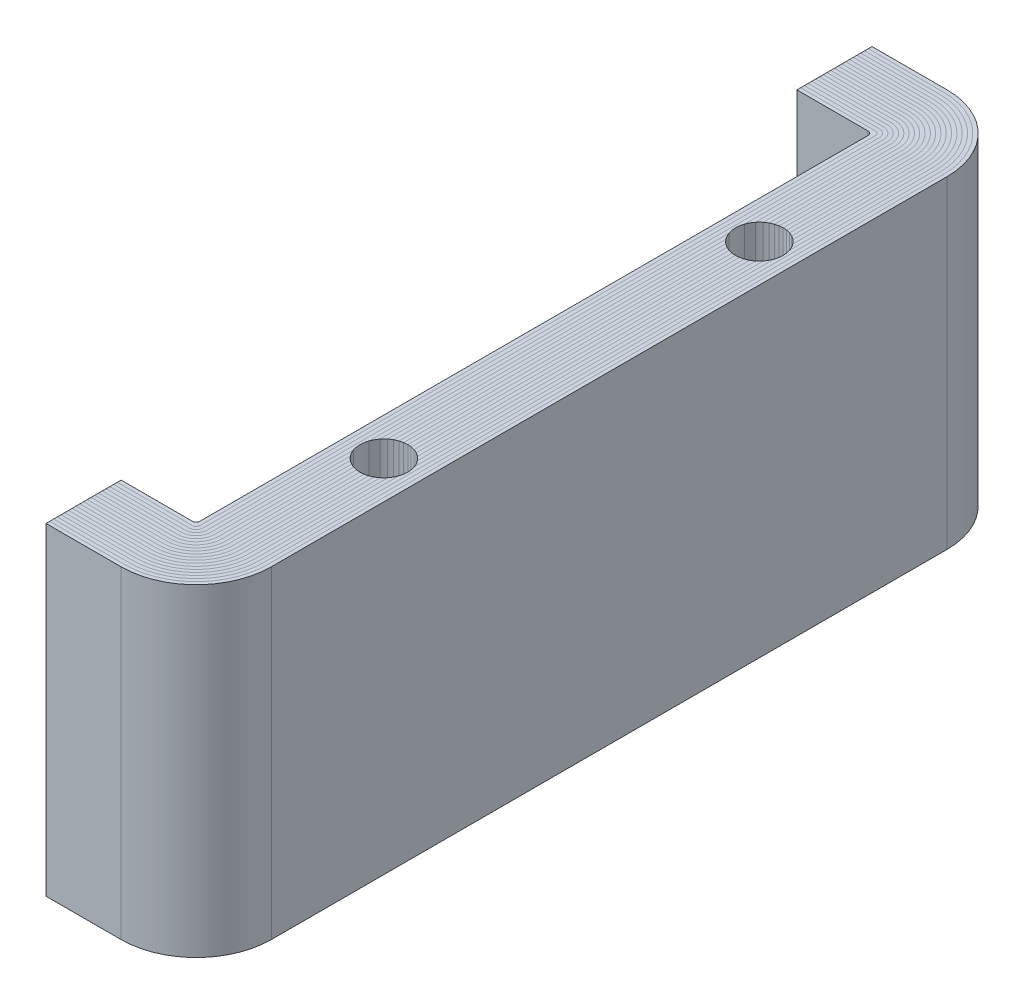
from build123d import *

# Parameters (mm, degrees)
ESBO_O2_W                                    = 110
ESBO_O2_H                                    = 43
RESSALTO_EXTRUS_O7_DEPTH                     = 0.5
ESBO_O18_W                                   = 10
ESBO_O18_H                                   = 43
RESSALTO_EXTRUS_O8_DEPTH                     = 19.5
CORTE_EXTRUS_O6_DEPTH                        = 120.704845349
CORTE_EXTRUS_O7_DEPTH                        = 120.704845349
RESSALTO_EXTRUS_O20_DEPTH                    = 43
RESSALTO_EXTRUS_O21_DEPTH                    = 43
RESSALTO_EXTRUS_O22_DEPTH                    = 43
RESSALTO_EXTRUS_O23_DEPTH                    = 43
RESSALTO_EXTRUS_O24_DEPTH                    = 43
RESSALTO_EXTRUS_O25_DEPTH                    = 43
RESSALTO_EXTRUS_O26_DEPTH                    = 43
RESSALTO_EXTRUS_O27_DEPTH                    = 43
RESSALTO_EXTRUS_O28_DEPTH                    = 43
RESSALTO_EXTRUS_O29_DEPTH                    = 43
RESSALTO_EXTRUS_O30_DEPTH                    = 43
RESSALTO_EXTRUS_O31_DEPTH                    = 43
RESSALTO_EXTRUS_O32_DEPTH                    = 43
RESSALTO_EXTRUS_O33_DEPTH                    = 43
RESSALTO_EXTRUS_O34_DEPTH                    = 43
RESSALTO_EXTRUS_O35_DEPTH                    = 43
RESSALTO_EXTRUS_O37_DEPTH                    = 43
RESSALTO_EXTRUS_O38_DEPTH                    = 43
RESSALTO_EXTRUS_O39_DEPTH                    = 43
BROCA_DE_ROSQUEAR_PARA_TARRAXA_DE_M3_2_COUNT = 2
BROCA_DE_ROSQUEAR_PARA_TARRAXA_DE_M3_2_PITCH = 50


with BuildPart() as part:
    # Esboço2 → Ressalto-extrusão7 (new body)
    with BuildSketch(Plane(origin=(0, 0, 0), x_dir=(0, 0, -1), z_dir=(1, 0, 0))):
        with Locations((-55, 21.5)):
            Rectangle(ESBO_O2_W, ESBO_O2_H)
    extrude(amount=RESSALTO_EXTRUS_O7_DEPTH)

    # Esboço18 → Ressalto-extrusão8 (add)
    with BuildSketch(Plane.ZY):
        with Locations((5, 21.5)):
            Rectangle(ESBO_O18_W, ESBO_O18_H)
        with Locations((105, 21.5)):
            Rectangle(ESBO_O18_W, ESBO_O18_H)
    extrude(amount=RESSALTO_EXTRUS_O8_DEPTH)

    # Esboço29 → Corte-extrusão6 (cut, through all)
    with BuildSketch(Plane(origin=(0, 43, 0), x_dir=(1, 0, 0), z_dir=(0, 1, 0))):
        with BuildLine():
            Line((-9.5, -110), (0.5, -110))
            Line((0.5, -110), (0.5, -100))
            ThreePointArc((0.5, -100), (-2.428932188, -107.071067812), (-9.5, -110))
        make_face()
        with BuildLine():
            Line((0.5, -10), (0.5, 0))
            Line((0.5, 0), (-9.5, 0))
            ThreePointArc((-9.5, 0), (-2.428932188, -2.928932188), (0.5, -10))
        make_face()
    extrude(amount=-CORTE_EXTRUS_O6_DEPTH, mode=Mode.SUBTRACT)

    # Esboço30 → Corte-extrusão7 (cut, through all)
    with BuildSketch(Plane(origin=(0, 43, 0), x_dir=(1, 0, 0), z_dir=(0, 1, 0))):
        with BuildLine():
            Line((-9.5, -109.5), (-19.5, -109.5))
            Line((-19.5, -109.5), (-19.5, -100))
            Line((-19.5, -100), (0, -100))
            ThreePointArc((0, -100), (-2.782485579, -106.717514421), (-9.5, -109.5))
        make_face()
        with BuildLine():
            Line((-9.5, -0.5), (-19.5, -0.5))
            Line((-19.5, -0.5), (-19.5, -10))
            Line((-19.5, -10), (0, -10))
            ThreePointArc((0, -10), (-2.782485579, -3.282485579), (-9.5, -0.5))
        make_face()
    extrude(amount=-CORTE_EXTRUS_O7_DEPTH, mode=Mode.SUBTRACT)


with BuildPart() as body_2:
    # Esboço31 → Ressalto-extrusão20 (new body)
    with BuildSketch(Plane(origin=(0, 43, 0), x_dir=(1, 0, 0), z_dir=(0, 1, 0))):
        with BuildLine():
            Line((-9.5, -109.5), (-19.5, -109.5))
            Line((-19.5, -109.5), (-19.5, -109))
            Line((-19.5, -109), (-9.5, -109))
            ThreePointArc((-9.5, -109), (-3.136038969, -106.363961031), (-0.5, -100))
            Line((-0.5, -100), (-0.5, -10))
            ThreePointArc((-0.5, -10), (-3.136038969, -3.636038969), (-9.5, -1))
            Line((-9.5, -1), (-19.5, -1))
            Line((-19.5, -1), (-19.5, -0.5))
            Line((-19.5, -0.5), (-9.5, -0.5))
            ThreePointArc((-9.5, -0.5), (-2.782485579, -3.282485579), (0, -10))
            Line((0, -10), (0, -100))
            ThreePointArc((0, -100), (-2.782485579, -106.717514421), (-9.5, -109.5))
        make_face()
    extrude(amount=-RESSALTO_EXTRUS_O20_DEPTH)


with BuildPart() as body_3:
    # Esboço32 → Ressalto-extrusão21 (new body)
    with BuildSketch(Plane(origin=(0, 43, 0), x_dir=(1, 0, 0), z_dir=(0, 1, 0))):
        with BuildLine():
            Line((-9.5, -1.5), (-19.5, -1.5))
            Line((-19.5, -1.5), (-19.5, -1))
            Line((-19.5, -1), (-9.5, -1))
            ThreePointArc((-9.5, -1), (-3.136038969, -3.636038969), (-0.5, -10))
            Line((-0.5, -10), (-0.5, -100))
            ThreePointArc((-0.5, -100), (-3.136038969, -106.363961031), (-9.5, -109))
            Line((-9.5, -109), (-19.5, -109))
            Line((-19.5, -109), (-19.5, -108.5))
            Line((-19.5, -108.5), (-9.5, -108.5))
            ThreePointArc((-9.5, -108.5), (-3.48959236, -106.01040764), (-1, -100))
            Line((-1, -100), (-1, -10))
            ThreePointArc((-1, -10), (-3.48959236, -3.98959236), (-9.5, -1.5))
        make_face()
    extrude(amount=-RESSALTO_EXTRUS_O21_DEPTH)


with BuildPart() as body_4:
    # Esboço33 → Ressalto-extrusão22 (new body)
    with BuildSketch(Plane(origin=(0, 43, 0), x_dir=(1, 0, 0), z_dir=(0, 1, 0))):
        with BuildLine():
            Line((-9.5, -1.5), (-19.5, -1.5))
            Line((-19.5, -1.5), (-19.5, -2))
            Line((-19.5, -2), (-9.5, -2))
            ThreePointArc((-9.5, -2), (-3.843145751, -4.343145751), (-1.5, -10))
            Line((-1.5, -10), (-1.5, -100))
            ThreePointArc((-1.5, -100), (-3.843145751, -105.656854249), (-9.5, -108))
            Line((-9.5, -108), (-19.5, -108))
            Line((-19.5, -108), (-19.5, -108.5))
            Line((-19.5, -108.5), (-9.5, -108.5))
            ThreePointArc((-9.5, -108.5), (-3.48959236, -106.01040764), (-1, -100))
            Line((-1, -100), (-1, -10))
            ThreePointArc((-1, -10), (-3.48959236, -3.98959236), (-9.5, -1.5))
        make_face()
    extrude(amount=-RESSALTO_EXTRUS_O22_DEPTH)


with BuildPart() as body_5:
    # Esboço34 → Ressalto-extrusão23 (new body)
    with BuildSketch(Plane(origin=(0, 43, 0), x_dir=(1, 0, 0), z_dir=(0, 1, 0))):
        with BuildLine():
            Line((-9.5, -108), (-19.5, -108))
            Line((-19.5, -108), (-19.5, -107.5))
            Line((-19.5, -107.5), (-9.5, -107.5))
            ThreePointArc((-9.5, -107.5), (-4.196699141, -105.303300859), (-2, -100))
            Line((-2, -100), (-2, -10))
            ThreePointArc((-2, -10), (-4.196699141, -4.696699141), (-9.5, -2.5))
            Line((-9.5, -2.5), (-19.5, -2.5))
            Line((-19.5, -2.5), (-19.5, -2))
            Line((-19.5, -2), (-9.5, -2))
            ThreePointArc((-9.5, -2), (-3.843145751, -4.343145751), (-1.5, -10))
            Line((-1.5, -10), (-1.5, -100))
            ThreePointArc((-1.5, -100), (-3.843145751, -105.656854249), (-9.5, -108))
        make_face()
    extrude(amount=-RESSALTO_EXTRUS_O23_DEPTH)


with BuildPart() as body_6:
    # Esboço35 → Ressalto-extrusão24 (new body)
    with BuildSketch(Plane(origin=(0, 43, 0), x_dir=(1, 0, 0), z_dir=(0, 1, 0))):
        with BuildLine():
            Line((-9.5, -107.5), (-19.5, -107.5))
            Line((-19.5, -107.5), (-19.5, -106.999999869))
            Line((-19.5, -106.999999869), (-9.5, -106.999999869))
            ThreePointArc((-9.5, -106.999999869), (-4.550252532, -104.949747468), (-2.5, -100))
            Line((-2.5, -100), (-2.5, -10))
            ThreePointArc((-2.5, -10), (-4.550252532, -5.050252532), (-9.5, -3))
            Line((-9.5, -3), (-19.5, -3))
            Line((-19.5, -3), (-19.5, -2.5))
            Line((-19.5, -2.5), (-9.5, -2.5))
            ThreePointArc((-9.5, -2.5), (-4.196699141, -4.696699141), (-2, -10))
            Line((-2, -10), (-2, -100))
            ThreePointArc((-2, -100), (-4.196699141, -105.303300859), (-9.5, -107.5))
        make_face()
    extrude(amount=-RESSALTO_EXTRUS_O24_DEPTH)


with BuildPart() as body_7:
    # Esboço36 → Ressalto-extrusão25 (new body)
    with BuildSketch(Plane(origin=(0, 43, 0), x_dir=(1, 0, 0), z_dir=(0, 1, 0))):
        with BuildLine():
            Line((-9.5, -106.999999869), (-19.5, -106.999999869))
            Line((-19.5, -106.999999869), (-19.5, -106.5))
            Line((-19.5, -106.5), (-9.5, -106.5))
            ThreePointArc((-9.5, -106.5), (-4.903805922, -104.596194078), (-3, -100))
            Line((-3, -100), (-3, -10))
            ThreePointArc((-3, -10), (-4.903805922, -5.403805922), (-9.5, -3.5))
            Line((-9.5, -3.5), (-19.5, -3.5))
            Line((-19.5, -3.5), (-19.5, -3))
            Line((-19.5, -3), (-9.5, -3))
            ThreePointArc((-9.5, -3), (-4.550252555, -5.050252555), (-2.500000033, -10))
            Line((-2.500000033, -10), (-2.500000033, -100))
            ThreePointArc((-2.500000033, -100), (-4.550252555, -104.949747445), (-9.5, -106.999999869))
        make_face()
    extrude(amount=-RESSALTO_EXTRUS_O25_DEPTH)


with BuildPart() as body_8:
    # Esboço38 → Ressalto-extrusão26 (new body)
    with BuildSketch(Plane(origin=(0, 43, 0), x_dir=(1, 0, 0), z_dir=(0, 1, 0))):
        with BuildLine():
            Line((-9.5, -106.5), (-19.5, -106.5))
            Line((-19.5, -106.5), (-19.5, -106))
            Line((-19.5, -106), (-9.5, -106))
            ThreePointArc((-9.5, -106), (-5.257359313, -104.242640687), (-3.5, -100))
            Line((-3.5, -100), (-3.5, -10))
            ThreePointArc((-3.5, -10), (-5.257359313, -5.757359313), (-9.5, -4))
            Line((-9.5, -4), (-19.5, -4))
            Line((-19.5, -4), (-19.5, -3.5))
            Line((-19.5, -3.5), (-9.5, -3.5))
            ThreePointArc((-9.5, -3.5), (-4.903805922, -5.403805922), (-3, -10))
            Line((-3, -10), (-3, -100))
            ThreePointArc((-3, -100), (-4.903805922, -104.596194078), (-9.5, -106.5))
        make_face()
    extrude(amount=-RESSALTO_EXTRUS_O26_DEPTH)


with BuildPart() as body_9:
    # Esboço39 → Ressalto-extrusão27 (new body)
    with BuildSketch(Plane(origin=(0, 43, 0), x_dir=(1, 0, 0), z_dir=(0, 1, 0))):
        with BuildLine():
            Line((-9.5, -106), (-19.5, -106))
            Line((-19.5, -106), (-19.5, -105.5))
            Line((-19.5, -105.5), (-9.5, -105.5))
            ThreePointArc((-9.5, -105.5), (-5.610912703, -103.889087297), (-4, -100))
            Line((-4, -100), (-4, -10))
            ThreePointArc((-4, -10), (-5.610912703, -6.110912703), (-9.5, -4.5))
            Line((-9.5, -4.5), (-19.5, -4.5))
            Line((-19.5, -4.5), (-19.5, -4))
            Line((-19.5, -4), (-9.5, -4))
            ThreePointArc((-9.5, -4), (-5.257359313, -5.757359313), (-3.5, -10))
            Line((-3.5, -10), (-3.5, -100))
            ThreePointArc((-3.5, -100), (-5.257359313, -104.242640687), (-9.5, -106))
        make_face()
    extrude(amount=-RESSALTO_EXTRUS_O27_DEPTH)


with BuildPart() as body_10:
    # Esboço40 → Ressalto-extrusão28 (new body)
    with BuildSketch(Plane(origin=(0, 43, 0), x_dir=(1, 0, 0), z_dir=(0, 1, 0))):
        with BuildLine():
            Line((-9.5, -105.5), (-19.5, -105.5))
            Line((-19.5, -105.5), (-19.5, -105))
            Line((-19.5, -105), (-9.5, -105))
            ThreePointArc((-9.5, -105), (-5.964466094, -103.535533906), (-4.5, -100))
            Line((-4.5, -100), (-4.5, -10))
            ThreePointArc((-4.5, -10), (-5.964466094, -6.464466094), (-9.5, -5))
            Line((-9.5, -5), (-19.5, -5))
            Line((-19.5, -5), (-19.5, -4.5))
            Line((-19.5, -4.5), (-9.5, -4.5))
            ThreePointArc((-9.5, -4.5), (-5.610912703, -6.110912703), (-4, -10))
            Line((-4, -10), (-4, -100))
            ThreePointArc((-4, -100), (-5.610912703, -103.889087297), (-9.5, -105.5))
        make_face()
    extrude(amount=-RESSALTO_EXTRUS_O28_DEPTH)


with BuildPart() as body_11:
    # Esboço41 → Ressalto-extrusão29 (new body)
    with BuildSketch(Plane(origin=(0, 43, 0), x_dir=(1, 0, 0), z_dir=(0, 1, 0))):
        with BuildLine():
            Line((-9.5, -105), (-19.5, -105))
            Line((-19.5, -105), (-19.5, -104.5))
            Line((-19.5, -104.5), (-9.5, -104.5))
            ThreePointArc((-9.5, -104.5), (-6.318019485, -103.181980515), (-5, -100))
            Line((-5, -100), (-5, -10))
            ThreePointArc((-5, -10), (-6.318019485, -6.818019485), (-9.5, -5.5))
            Line((-9.5, -5.5), (-19.5, -5.5))
            Line((-19.5, -5.5), (-19.5, -5))
            Line((-19.5, -5), (-9.5, -5))
            ThreePointArc((-9.5, -5), (-5.964466094, -6.464466094), (-4.5, -10))
            Line((-4.5, -10), (-4.5, -100))
            ThreePointArc((-4.5, -100), (-5.964466094, -103.535533906), (-9.5, -105))
        make_face()
    extrude(amount=-RESSALTO_EXTRUS_O29_DEPTH)


with BuildPart() as body_12:
    # Esboço42 → Ressalto-extrusão30 (new body)
    with BuildSketch(Plane(origin=(0, 43, 0), x_dir=(1, 0, 0), z_dir=(0, 1, 0))):
        with BuildLine():
            Line((-9.5, -104.5), (-19.5, -104.5))
            Line((-19.5, -104.5), (-19.5, -104))
            Line((-19.5, -104), (-9.5, -104))
            ThreePointArc((-9.5, -104), (-6.671572875, -102.828427125), (-5.5, -100))
            Line((-5.5, -100), (-5.5, -10))
            ThreePointArc((-5.5, -10), (-6.671572875, -7.171572875), (-9.5, -6))
            Line((-9.5, -6), (-19.5, -6))
            Line((-19.5, -6), (-19.5, -5.5))
            Line((-19.5, -5.5), (-9.5, -5.5))
            ThreePointArc((-9.5, -5.5), (-6.318019485, -6.818019485), (-5, -10))
            Line((-5, -10), (-5, -100))
            ThreePointArc((-5, -100), (-6.318019485, -103.181980515), (-9.5, -104.5))
        make_face()
    extrude(amount=-RESSALTO_EXTRUS_O30_DEPTH)


with BuildPart() as body_13:
    # Esboço43 → Ressalto-extrusão31 (new body)
    with BuildSketch(Plane(origin=(0, 43, 0), x_dir=(1, 0, 0), z_dir=(0, 1, 0))):
        with BuildLine():
            Line((-9.5, -104), (-19.5, -104))
            Line((-19.5, -104), (-19.5, -103.5))
            Line((-19.5, -103.5), (-9.5, -103.5))
            ThreePointArc((-9.5, -103.5), (-7.025126266, -102.474873734), (-6, -100))
            Line((-6, -100), (-6, -10))
            ThreePointArc((-6, -10), (-7.025126266, -7.525126266), (-9.5, -6.5))
            Line((-9.5, -6.5), (-19.5, -6.5))
            Line((-19.5, -6.5), (-19.5, -6))
            Line((-19.5, -6), (-9.5, -6))
            ThreePointArc((-9.5, -6), (-6.671572875, -7.171572875), (-5.5, -10))
            Line((-5.5, -10), (-5.5, -100))
            ThreePointArc((-5.5, -100), (-6.671572875, -102.828427125), (-9.5, -104))
        make_face()
    extrude(amount=-RESSALTO_EXTRUS_O31_DEPTH)


with BuildPart() as body_14:
    # Esboço44 → Ressalto-extrusão32 (new body)
    with BuildSketch(Plane(origin=(0, 43, 0), x_dir=(1, 0, 0), z_dir=(0, 1, 0))):
        with BuildLine():
            Line((-9.5, -103.5), (-19.5, -103.5))
            Line((-19.5, -103.5), (-19.5, -103))
            Line((-19.5, -103), (-9.5, -103))
            ThreePointArc((-9.5, -103), (-7.378679656, -102.121320344), (-6.5, -100))
            Line((-6.5, -100), (-6.5, -10))
            ThreePointArc((-6.5, -10), (-7.378679656, -7.878679656), (-9.5, -7))
            Line((-9.5, -7), (-19.5, -7))
            Line((-19.5, -7), (-19.5, -6.5))
            Line((-19.5, -6.5), (-9.5, -6.5))
            ThreePointArc((-9.5, -6.5), (-7.025126266, -7.525126266), (-6, -10))
            Line((-6, -10), (-6, -100))
            ThreePointArc((-6, -100), (-7.025126266, -102.474873734), (-9.5, -103.5))
        make_face()
    extrude(amount=-RESSALTO_EXTRUS_O32_DEPTH)


with BuildPart() as body_15:
    # Esboço45 → Ressalto-extrusão33 (new body)
    with BuildSketch(Plane(origin=(0, 43, 0), x_dir=(1, 0, 0), z_dir=(0, 1, 0))):
        with BuildLine():
            Line((-9.5, -103), (-19.5, -103))
            Line((-19.5, -103), (-19.5, -102.5))
            Line((-19.5, -102.5), (-9.5, -102.5))
            ThreePointArc((-9.5, -102.5), (-7.732233047, -101.767766953), (-7, -100))
            Line((-7, -100), (-7, -10))
            ThreePointArc((-7, -10), (-7.732233047, -8.232233047), (-9.5, -7.5))
            Line((-9.5, -7.5), (-19.5, -7.5))
            Line((-19.5, -7.5), (-19.5, -7))
            Line((-19.5, -7), (-9.5, -7))
            ThreePointArc((-9.5, -7), (-7.378679656, -7.878679656), (-6.5, -10))
            Line((-6.5, -10), (-6.5, -100))
            ThreePointArc((-6.5, -100), (-7.378679656, -102.121320344), (-9.5, -103))
        make_face()
    extrude(amount=-RESSALTO_EXTRUS_O33_DEPTH)


with BuildPart() as body_16:
    # Esboço46 → Ressalto-extrusão34 (new body)
    with BuildSketch(Plane(origin=(0, 43, 0), x_dir=(1, 0, 0), z_dir=(0, 1, 0))):
        with BuildLine():
            Line((-9.5, -102.5), (-19.5, -102.5))
            Line((-19.5, -102.5), (-19.5, -102))
            Line((-19.5, -102), (-9.5, -102))
            ThreePointArc((-9.5, -102), (-8.085786438, -101.414213562), (-7.5, -100))
            Line((-7.5, -100), (-7.5, -10))
            ThreePointArc((-7.5, -10), (-8.085786438, -8.585786438), (-9.5, -8))
            Line((-9.5, -8), (-19.5, -8))
            Line((-19.5, -8), (-19.5, -7.5))
            Line((-19.5, -7.5), (-9.5, -7.5))
            ThreePointArc((-9.5, -7.5), (-7.732233047, -8.232233047), (-7, -10))
            Line((-7, -10), (-7, -100))
            ThreePointArc((-7, -100), (-7.732233047, -101.767766953), (-9.5, -102.5))
        make_face()
    extrude(amount=-RESSALTO_EXTRUS_O34_DEPTH)


with BuildPart() as body_17:
    # Esboço47 → Ressalto-extrusão35 (new body)
    with BuildSketch(Plane(origin=(0, 43, 0), x_dir=(1, 0, 0), z_dir=(0, 1, 0))):
        with BuildLine():
            Line((-9.5, -102), (-19.5, -102))
            Line((-19.5, -102), (-19.5, -101.5))
            Line((-19.5, -101.5), (-9.5, -101.5))
            ThreePointArc((-9.5, -101.5), (-8.439339828, -101.060660172), (-8, -100))
            Line((-8, -100), (-8, -10))
            ThreePointArc((-8, -10), (-8.439339828, -8.939339828), (-9.5, -8.5))
            Line((-9.5, -8.5), (-19.5, -8.5))
            Line((-19.5, -8.5), (-19.5, -8))
            Line((-19.5, -8), (-9.5, -8))
            ThreePointArc((-9.5, -8), (-8.085786438, -8.585786438), (-7.5, -10))
            Line((-7.5, -10), (-7.5, -100))
            ThreePointArc((-7.5, -100), (-8.085786438, -101.414213562), (-9.5, -102))
        make_face()
    extrude(amount=-RESSALTO_EXTRUS_O35_DEPTH)


with BuildPart() as body_18:
    # Esboço48 → Ressalto-extrusão37 (new body)
    with BuildSketch(Plane(origin=(0, 43, 0), x_dir=(1, 0, 0), z_dir=(0, 1, 0))):
        with BuildLine():
            Line((-9.5, -101.5), (-19.5, -101.5))
            Line((-19.5, -101.5), (-19.5, -101))
            Line((-19.5, -101), (-9.5, -101))
            ThreePointArc((-9.5, -101), (-8.792893219, -100.707106781), (-8.5, -100))
            Line((-8.5, -100), (-8.5, -10))
            ThreePointArc((-8.5, -10), (-8.792893219, -9.292893219), (-9.5, -9))
            Line((-9.5, -9), (-19.5, -9))
            Line((-19.5, -9), (-19.5, -8.5))
            Line((-19.5, -8.5), (-9.5, -8.5))
            ThreePointArc((-9.5, -8.5), (-8.439339828, -8.939339828), (-8, -10))
            Line((-8, -10), (-8, -100))
            ThreePointArc((-8, -100), (-8.439339828, -101.060660172), (-9.5, -101.5))
        make_face()
    extrude(amount=-RESSALTO_EXTRUS_O37_DEPTH)


with BuildPart() as body_19:
    # Esboço49 → Ressalto-extrusão38 (new body)
    with BuildSketch(Plane(origin=(0, 43, 0), x_dir=(1, 0, 0), z_dir=(0, 1, 0))):
        with BuildLine():
            Line((-9.5, -101), (-19.5, -101))
            Line((-19.5, -101), (-19.5, -100.5))
            Line((-19.5, -100.5), (-9.5, -100.5))
            ThreePointArc((-9.5, -100.5), (-9.146446609, -100.353553391), (-9, -100))
            Line((-9, -100), (-9, -10))
            ThreePointArc((-9, -10), (-9.146446609, -9.646446609), (-9.5, -9.5))
            Line((-9.5, -9.5), (-19.5, -9.5))
            Line((-19.5, -9.5), (-19.5, -9))
            Line((-19.5, -9), (-9.5, -9))
            ThreePointArc((-9.5, -9), (-8.792893219, -9.292893219), (-8.5, -10))
            Line((-8.5, -10), (-8.5, -100))
            ThreePointArc((-8.5, -100), (-8.792893219, -100.707106781), (-9.5, -101))
        make_face()
    extrude(amount=-RESSALTO_EXTRUS_O38_DEPTH)


with BuildPart() as body_20:
    # Esboço50 → Ressalto-extrusão39 (new body)
    with BuildSketch(Plane(origin=(0, 43, 0), x_dir=(1, 0, 0), z_dir=(0, 1, 0))):
        with BuildLine():
            Line((-9.5, -100.5), (-19.5, -100.5))
            Line((-19.5, -100.5), (-19.5, -100))
            Line((-19.5, -100), (-10, -100))
            ThreePointArc((-10, -100), (-9.646446609, -99.853553391), (-9.5, -99.5))
            Line((-9.5, -99.5), (-9.5, -10.5))
            ThreePointArc((-9.5, -10.5), (-9.646446609, -10.146446609), (-10, -10))
            Line((-10, -10), (-19.5, -10))
            Line((-19.5, -10), (-19.5, -9.5))
            Line((-19.5, -9.5), (-9.5, -9.5))
            ThreePointArc((-9.5, -9.5), (-9.146446609, -9.646446609), (-9, -10))
            Line((-9, -10), (-9, -100))
            ThreePointArc((-9, -100), (-9.146446609, -100.353553391), (-9.5, -100.5))
        make_face()
    extrude(amount=-RESSALTO_EXTRUS_O39_DEPTH)


with BuildPart() as broca_de_rosquear_para_tarraxa_de_m3x0_5_tool:
    # Esboço52 → Broca de rosquear para tarraxa de M3x0.51 (revolve)
    with BuildSketch(Plane(origin=(-4.5, 43, 80), x_dir=(0, 0, 1), z_dir=(1, 0, 0))):
        Polygon((0, 0), (0, 23.49), (3.175, 21.582267535), (3.175, 0), align=None)
    broca_de_rosquear_para_tarraxa_de_m3x0_5 = revolve(axis=Axis((-4.5, 49.35, 80), (0, -1, 0)))


with BuildPart() as body_4_1:
    add(body_4.part)

    # Broca de rosquear para tarraxa de M3x0.51: cut by broca_de_rosquear_para_tarraxa_de_m3x0_5_tool
    add(broca_de_rosquear_para_tarraxa_de_m3x0_5_tool.part, mode=Mode.SUBTRACT)


with BuildPart() as body_5_1:
    add(body_5.part)

    # Broca de rosquear para tarraxa de M3x0.51: cut by broca_de_rosquear_para_tarraxa_de_m3x0_5_tool
    add(broca_de_rosquear_para_tarraxa_de_m3x0_5_tool.part, mode=Mode.SUBTRACT)


with BuildPart() as body_6_1:
    add(body_6.part)

    # Broca de rosquear para tarraxa de M3x0.51: cut by broca_de_rosquear_para_tarraxa_de_m3x0_5_tool
    add(broca_de_rosquear_para_tarraxa_de_m3x0_5_tool.part, mode=Mode.SUBTRACT)


with BuildPart() as body_7_1:
    add(body_7.part)

    # Broca de rosquear para tarraxa de M3x0.51: cut by broca_de_rosquear_para_tarraxa_de_m3x0_5_tool
    add(broca_de_rosquear_para_tarraxa_de_m3x0_5_tool.part, mode=Mode.SUBTRACT)


with BuildPart() as body_8_1:
    add(body_8.part)

    # Broca de rosquear para tarraxa de M3x0.51: cut by broca_de_rosquear_para_tarraxa_de_m3x0_5_tool
    add(broca_de_rosquear_para_tarraxa_de_m3x0_5_tool.part, mode=Mode.SUBTRACT)


with BuildPart() as body_9_1:
    add(body_9.part)

    # Broca de rosquear para tarraxa de M3x0.51: cut by broca_de_rosquear_para_tarraxa_de_m3x0_5_tool
    add(broca_de_rosquear_para_tarraxa_de_m3x0_5_tool.part, mode=Mode.SUBTRACT)


with BuildPart() as body_10_1:
    add(body_10.part)

    # Broca de rosquear para tarraxa de M3x0.51: cut by broca_de_rosquear_para_tarraxa_de_m3x0_5_tool
    add(broca_de_rosquear_para_tarraxa_de_m3x0_5_tool.part, mode=Mode.SUBTRACT)


with BuildPart() as body_11_1:
    add(body_11.part)

    # Broca de rosquear para tarraxa de M3x0.51: cut by broca_de_rosquear_para_tarraxa_de_m3x0_5_tool
    add(broca_de_rosquear_para_tarraxa_de_m3x0_5_tool.part, mode=Mode.SUBTRACT)


with BuildPart() as body_12_1:
    add(body_12.part)

    # Broca de rosquear para tarraxa de M3x0.51: cut by broca_de_rosquear_para_tarraxa_de_m3x0_5_tool
    add(broca_de_rosquear_para_tarraxa_de_m3x0_5_tool.part, mode=Mode.SUBTRACT)


with BuildPart() as body_13_1:
    add(body_13.part)

    # Broca de rosquear para tarraxa de M3x0.51: cut by broca_de_rosquear_para_tarraxa_de_m3x0_5_tool
    add(broca_de_rosquear_para_tarraxa_de_m3x0_5_tool.part, mode=Mode.SUBTRACT)


with BuildPart() as body_14_1:
    add(body_14.part)

    # Broca de rosquear para tarraxa de M3x0.51: cut by broca_de_rosquear_para_tarraxa_de_m3x0_5_tool
    add(broca_de_rosquear_para_tarraxa_de_m3x0_5_tool.part, mode=Mode.SUBTRACT)


with BuildPart() as body_15_1:
    add(body_15.part)

    # Broca de rosquear para tarraxa de M3x0.51: cut by broca_de_rosquear_para_tarraxa_de_m3x0_5_tool
    add(broca_de_rosquear_para_tarraxa_de_m3x0_5_tool.part, mode=Mode.SUBTRACT)


with BuildPart() as body_16_1:
    add(body_16.part)

    # Broca de rosquear para tarraxa de M3x0.51: cut by broca_de_rosquear_para_tarraxa_de_m3x0_5_tool
    add(broca_de_rosquear_para_tarraxa_de_m3x0_5_tool.part, mode=Mode.SUBTRACT)


with BuildPart() as body_17_1:
    add(body_17.part)

    # Broca de rosquear para tarraxa de M3x0.51: cut by broca_de_rosquear_para_tarraxa_de_m3x0_5_tool
    add(broca_de_rosquear_para_tarraxa_de_m3x0_5_tool.part, mode=Mode.SUBTRACT)


with BuildPart() as broca_de_rosquear_para_tarraxa_de_m3_2_tool:
    # Broca de rosquear para tarraxa de M3 2: Broca de rosquear para tarraxa de M3x0.51 ×2
    with Locations(*[(0, 0, -i * BROCA_DE_ROSQUEAR_PARA_TARRAXA_DE_M3_2_PITCH) for i in range(1, BROCA_DE_ROSQUEAR_PARA_TARRAXA_DE_M3_2_COUNT)]):
        add(broca_de_rosquear_para_tarraxa_de_m3x0_5)


with BuildPart() as body_4_2:
    add(body_4_1.part)

    # Broca de rosquear para tarraxa de M3 2: cut by broca_de_rosquear_para_tarraxa_de_m3_2_tool
    add(broca_de_rosquear_para_tarraxa_de_m3_2_tool.part, mode=Mode.SUBTRACT)


with BuildPart() as body_5_2:
    add(body_5_1.part)

    # Broca de rosquear para tarraxa de M3 2: cut by broca_de_rosquear_para_tarraxa_de_m3_2_tool
    add(broca_de_rosquear_para_tarraxa_de_m3_2_tool.part, mode=Mode.SUBTRACT)


with BuildPart() as body_6_2:
    add(body_6_1.part)

    # Broca de rosquear para tarraxa de M3 2: cut by broca_de_rosquear_para_tarraxa_de_m3_2_tool
    add(broca_de_rosquear_para_tarraxa_de_m3_2_tool.part, mode=Mode.SUBTRACT)


with BuildPart() as body_7_2:
    add(body_7_1.part)

    # Broca de rosquear para tarraxa de M3 2: cut by broca_de_rosquear_para_tarraxa_de_m3_2_tool
    add(broca_de_rosquear_para_tarraxa_de_m3_2_tool.part, mode=Mode.SUBTRACT)


with BuildPart() as body_8_2:
    add(body_8_1.part)

    # Broca de rosquear para tarraxa de M3 2: cut by broca_de_rosquear_para_tarraxa_de_m3_2_tool
    add(broca_de_rosquear_para_tarraxa_de_m3_2_tool.part, mode=Mode.SUBTRACT)


with BuildPart() as body_9_2:
    add(body_9_1.part)

    # Broca de rosquear para tarraxa de M3 2: cut by broca_de_rosquear_para_tarraxa_de_m3_2_tool
    add(broca_de_rosquear_para_tarraxa_de_m3_2_tool.part, mode=Mode.SUBTRACT)


with BuildPart() as body_10_2:
    add(body_10_1.part)

    # Broca de rosquear para tarraxa de M3 2: cut by broca_de_rosquear_para_tarraxa_de_m3_2_tool
    add(broca_de_rosquear_para_tarraxa_de_m3_2_tool.part, mode=Mode.SUBTRACT)


with BuildPart() as body_11_2:
    add(body_11_1.part)

    # Broca de rosquear para tarraxa de M3 2: cut by broca_de_rosquear_para_tarraxa_de_m3_2_tool
    add(broca_de_rosquear_para_tarraxa_de_m3_2_tool.part, mode=Mode.SUBTRACT)


with BuildPart() as body_12_2:
    add(body_12_1.part)

    # Broca de rosquear para tarraxa de M3 2: cut by broca_de_rosquear_para_tarraxa_de_m3_2_tool
    add(broca_de_rosquear_para_tarraxa_de_m3_2_tool.part, mode=Mode.SUBTRACT)


with BuildPart() as body_13_2:
    add(body_13_1.part)

    # Broca de rosquear para tarraxa de M3 2: cut by broca_de_rosquear_para_tarraxa_de_m3_2_tool
    add(broca_de_rosquear_para_tarraxa_de_m3_2_tool.part, mode=Mode.SUBTRACT)


with BuildPart() as body_14_2:
    add(body_14_1.part)

    # Broca de rosquear para tarraxa de M3 2: cut by broca_de_rosquear_para_tarraxa_de_m3_2_tool
    add(broca_de_rosquear_para_tarraxa_de_m3_2_tool.part, mode=Mode.SUBTRACT)


with BuildPart() as body_15_2:
    add(body_15_1.part)

    # Broca de rosquear para tarraxa de M3 2: cut by broca_de_rosquear_para_tarraxa_de_m3_2_tool
    add(broca_de_rosquear_para_tarraxa_de_m3_2_tool.part, mode=Mode.SUBTRACT)


with BuildPart() as body_16_2:
    add(body_16_1.part)

    # Broca de rosquear para tarraxa de M3 2: cut by broca_de_rosquear_para_tarraxa_de_m3_2_tool
    add(broca_de_rosquear_para_tarraxa_de_m3_2_tool.part, mode=Mode.SUBTRACT)


with BuildPart() as body_17_2:
    add(body_17_1.part)

    # Broca de rosquear para tarraxa de M3 2: cut by broca_de_rosquear_para_tarraxa_de_m3_2_tool
    add(broca_de_rosquear_para_tarraxa_de_m3_2_tool.part, mode=Mode.SUBTRACT)


solid = Compound([part.part, body_2.part, body_3.part, body_18.part, body_19.part, body_20.part, body_4_2.part, body_5_2.part, body_6_2.part, body_7_2.part, body_8_2.part, body_9_2.part, body_10_2.part, body_11_2.part, body_12_2.part, body_13_2.part, body_14_2.part, body_15_2.part, body_16_2.part, body_17_2.part])
